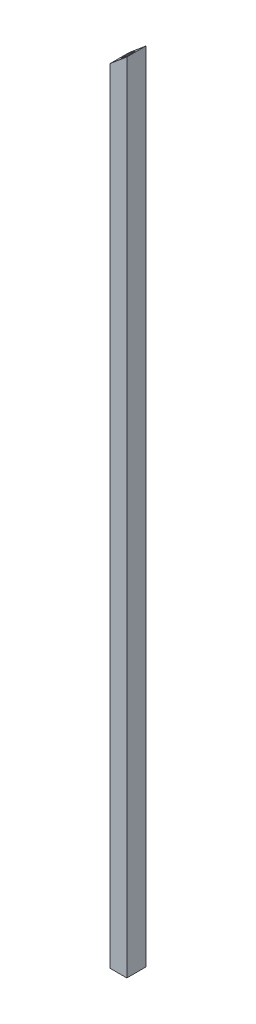
from build123d import *

# Parameters (mm, degrees)
SKETCH2_W           = 22.225
SKETCH2_H           = 1066.8
BOSS_EXTRUDE1_DEPTH = 12.7
SKETCH3_W           = 9.525
SKETCH3_H           = 12.7
CUT_EXTRUDE1_DEPTH  = 1067.933464494
CUT_EXTRUDE2_DEPTH  = 535.120031132


with BuildPart() as part:
    # Sketch2 → Boss-Extrude1 (new, symmetric)
    with BuildSketch(Plane.XY):
        Rectangle(SKETCH2_W, SKETCH2_H)
    extrude(amount=BOSS_EXTRUDE1_DEPTH, both=True)

    # Sketch3 → Cut-Extrude1 (cut, through all)
    with BuildSketch(Plane(origin=(0, 533.4, 0), x_dir=(1, 0, 0), z_dir=(0, 1, 0))):
        Rectangle(SKETCH3_W, SKETCH3_H)
    extrude(amount=-CUT_EXTRUDE1_DEPTH, mode=Mode.SUBTRACT)

    # Sketch4 → Cut-Extrude2 (cut, through all)
    with BuildSketch(Plane.XY.offset(12.7)):
        Polygon((11.1125, 533.4), (-11.1125, 514.751010697), (-11.1125, 533.4), align=None)
    extrude(amount=-CUT_EXTRUDE2_DEPTH, mode=Mode.SUBTRACT)


solid = part.part
